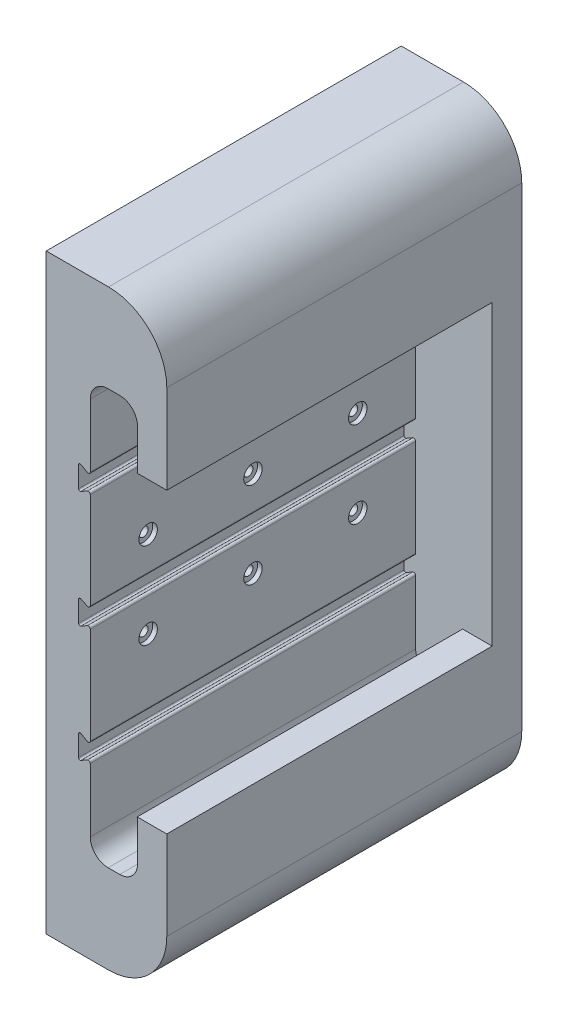
from build123d import *

# Parameters (mm, degrees)
BOSS_EXTRUDE1_DEPTH = 152.4
BOSS_EXTRUDE2_DEPTH = 12.7
SKETCH3_R           = 1.984375
CUT_EXTRUDE1_DEPTH  = 25
SKETCH4_R           = 3.96875
CUT_EXTRUDE2_DEPTH  = 2


with BuildPart() as part:
    # Sketch1 → Boss-Extrude1 (new body)
    with BuildSketch(Plane(origin=(0, 0, 0), x_dir=(0, 1, 0), z_dir=(0, 0, 1))):
        with BuildLine():
            Line((-93.406104195, 5.15), (-84.393895805, 5.15))
            ThreePointArc((-84.393895805, 5.15), (-83.845691366, 4.849244745), (-83.804795744, 4.22529813))
            Line((-83.804795744, 4.22529813), (-85.141267349, 1.359225522))
            ThreePointArc((-85.141267349, 1.359225522), (-85.087788459, 0.543295333), (-84.37090573, 0.15))
            Line((-84.37090573, 0.15), (-43.036246445, 0.15))
            ThreePointArc((-43.036246445, 0.15), (-42.300124852, 0.575), (-42.300124852, 1.425))
            Line((-42.300124852, 1.425), (-43.887838092, 4.175))
            ThreePointArc((-43.887838092, 4.175), (-43.887838092, 4.825), (-43.324921579, 5.15))
            Line((-43.324921579, 5.15), (-34.393895805, 5.15))
            ThreePointArc((-34.393895805, 5.15), (-33.830979293, 4.825), (-33.830979293, 4.175))
            Line((-33.830979293, 4.175), (-35.418692533, 1.425))
            ThreePointArc((-35.418692533, 1.425), (-35.418692533, 0.575), (-34.68257094, 0.15))
            Line((-34.68257094, 0.15), (-7.5, 0.15))
            ThreePointArc((-7.5, 0.15), (-2.090633124, -2.090633124), (0.15, -7.5))
            Line((0.15, -7.5), (0.15, -12.5))
            ThreePointArc((0.15, -12.5), (-2.090633124, -17.909366876), (-7.5, -20.15))
            Line((-7.5, -20.15), (-24.85, -20.15))
            Line((-24.85, -20.15), (-24.85, -20))
            Line((-24.85, -20), (-25, -20))
            Line((-25, -20), (-25, -32.7))
            Line((-25, -32.7), (13.1, -32.7))
            ThreePointArc((13.1, -32.7), (30.77766953, -25.37766953), (38.1, -7.7))
            Line((38.1, -7.7), (38.1, 19.05))
            Line((38.1, 19.05), (-215.9, 19.05))
            Line((-215.9, 19.05), (-215.9, -7.7))
            ThreePointArc((-215.9, -7.7), (-208.57766953, -25.37766953), (-190.9, -32.7))
            Line((-190.9, -32.7), (-152.8, -32.7))
            Line((-152.8, -32.7), (-152.8, -20))
            Line((-152.8, -20), (-152.95, -20))
            Line((-152.95, -20), (-152.95, -20.15))
            Line((-152.95, -20.15), (-170.3, -20.15))
            ThreePointArc((-170.3, -20.15), (-175.709366876, -17.909366876), (-177.95, -12.5))
            Line((-177.95, -12.5), (-177.95, -7.5))
            ThreePointArc((-177.95, -7.5), (-175.709366876, -2.090633124), (-170.3, 0.15))
            Line((-170.3, 0.15), (-143.036246445, 0.15))
            ThreePointArc((-143.036246445, 0.15), (-142.300124852, 0.575), (-142.300124852, 1.425))
            Line((-142.300124852, 1.425), (-143.887838092, 4.175))
            ThreePointArc((-143.887838092, 4.175), (-143.887838092, 4.825), (-143.324921579, 5.15))
            Line((-143.324921579, 5.15), (-134.393895805, 5.15))
            ThreePointArc((-134.393895805, 5.15), (-133.830979293, 4.825), (-133.830979293, 4.175))
            Line((-133.830979293, 4.175), (-135.418692533, 1.425))
            ThreePointArc((-135.418692533, 1.425), (-135.418692533, 0.575), (-134.68257094, 0.15))
            Line((-134.68257094, 0.15), (-93.11742906, 0.15))
            ThreePointArc((-93.11742906, 0.15), (-92.381307467, 0.575), (-92.381307467, 1.425))
            Line((-92.381307467, 1.425), (-93.969020707, 4.175))
            ThreePointArc((-93.969020707, 4.175), (-93.969020707, 4.825), (-93.406104195, 5.15))
        make_face()
    extrude(amount=BOSS_EXTRUDE1_DEPTH)

    # Sketch2 → Boss-Extrude2 (add)
    with BuildSketch(Plane(origin=(0, 0, 0), x_dir=(1, 0, 0), z_dir=(0, 0, -1))):
        Polygon((-19.05, 215.9), (-19.05, -38.1), (7.7, -38.1), (32.7, 25), (32.7, 152.8), (32.7, 190.9), (7.7, 215.9), align=None)
    extrude(amount=-BOSS_EXTRUDE2_DEPTH)

    # Sketch3 → Cut-Extrude1 (cut)
    with BuildSketch(Plane.YZ.offset(-0.15)):
        with Locations((-107.244167395, 37.55)):
            Circle(SKETCH3_R)
        with Locations((-107.244167395, 82.55)):
            Circle(SKETCH3_R)
        with Locations((-107.244167395, 127.55)):
            Circle(SKETCH3_R)
        with Locations((-70.244167395, 37.55)):
            Circle(SKETCH3_R)
        with Locations((-70.244167395, 82.55)):
            Circle(SKETCH3_R)
        with Locations((-70.244167395, 127.55)):
            Circle(SKETCH3_R)
    extrude(amount=-CUT_EXTRUDE1_DEPTH, mode=Mode.SUBTRACT)

    # Sketch4 → Cut-Extrude2 (cut)
    with BuildSketch(Plane.YZ.offset(-0.15)):
        with Locations((-107.244167395, 127.55)):
            Circle(SKETCH4_R)
        with Locations((-107.244167395, 82.55)):
            Circle(SKETCH4_R)
        with Locations((-107.244167395, 37.55)):
            Circle(SKETCH4_R)
        with Locations((-70.244167395, 37.55)):
            Circle(SKETCH4_R)
        with Locations((-70.244167395, 82.55)):
            Circle(SKETCH4_R)
        with Locations((-70.244167395, 127.55)):
            Circle(SKETCH4_R)
    extrude(amount=-CUT_EXTRUDE2_DEPTH, mode=Mode.SUBTRACT)


solid = part.part
